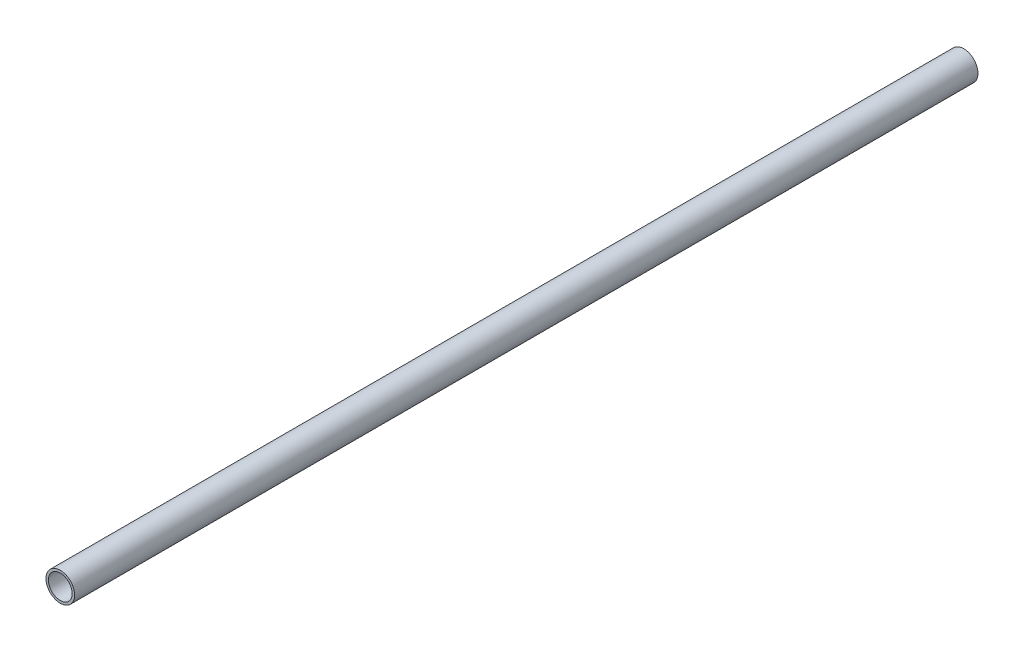
from build123d import *

# Parameters (mm, degrees)
SKETCH1_W = 300
SKETCH1_H = 0.8


with BuildPart() as part:
    # Sketch1 → Revolve1 (revolve)
    with BuildSketch(Plane(origin=(0, 0, 0), x_dir=(0, 0, -1), z_dir=(1, 0, 0)), mode=Mode.PRIVATE) as revolve1_sk:
        with Locations((150, 4.35)):
            Rectangle(SKETCH1_W, SKETCH1_H)
    revolve(revolve1_sk.sketch.rotate(Axis((0, 0, 0), (0, 0, -1)), 90), axis=Axis((0, 0, 0), (0, 0, -1)))


solid = part.part
